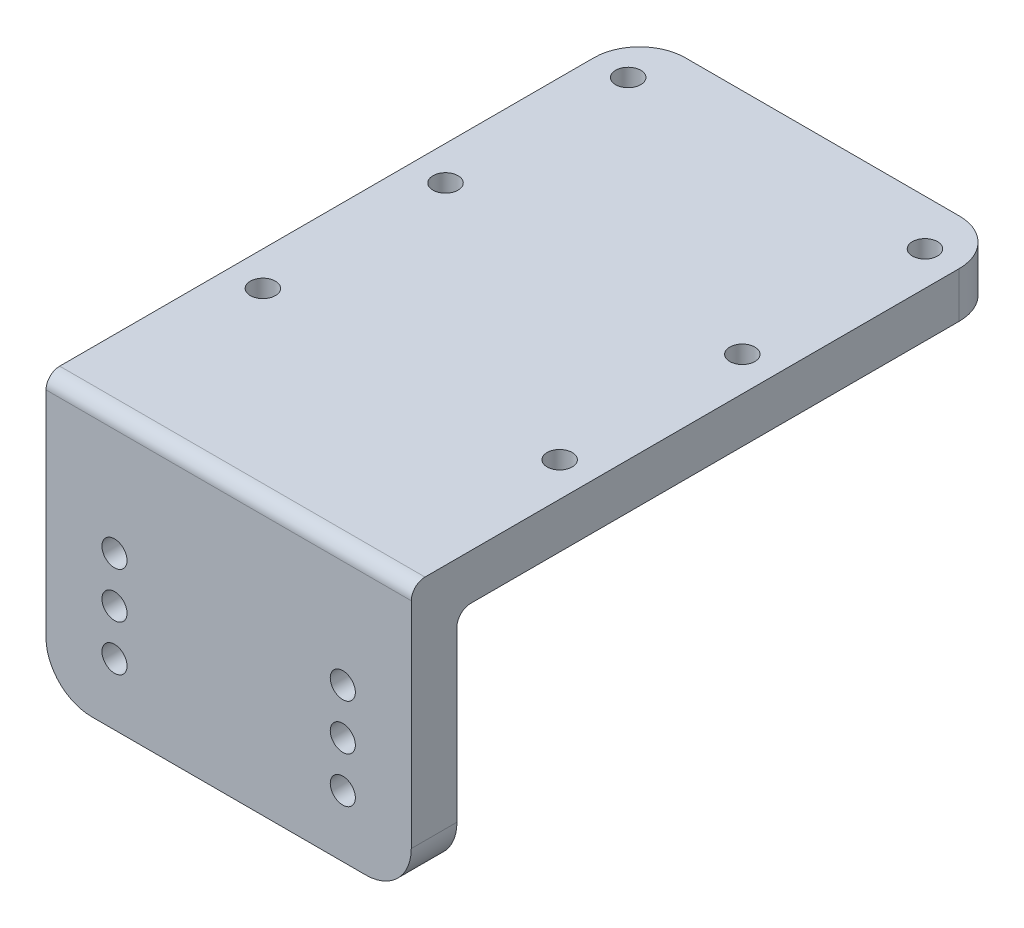
from build123d import *

# Parameters (mm, degrees)
SKETCH1_W           = 80
SKETCH1_H           = 60
BOSS_EXTRUDE1_DEPTH = 10
SKETCH2_W           = 80
SKETCH2_H           = 130
BOSS_EXTRUDE2_DEPTH = 10
CUT_EXTRUDE1_REACH  = 132
SKETCH3_R           = 2.75
CUT_EXTRUDE2_REACH  = 138.015
SKETCH4_R           = 2.75
SKETCH5_W           = 10
SKETCH5_H           = 50
BOSS_EXTRUDE3_DEPTH = 120
CUT_EXTRUDE3_REACH  = 133.624
FILLET1_R           = 10
FILLET2_R           = 3
FILLET3_R           = 3


with BuildPart() as part:
    # Sketch1 → Boss-Extrude1 (new body)
    with BuildSketch(Plane.XY):
        Rectangle(SKETCH1_W, SKETCH1_H)
    extrude(amount=BOSS_EXTRUDE1_DEPTH)

    # Sketch2 → Boss-Extrude2 (add)
    with BuildSketch(Plane(origin=(0, 30, 0), x_dir=(1, 0, 0), z_dir=(0, 1, 0))):
        with Locations((0, 55)):
            Rectangle(SKETCH2_W, SKETCH2_H)
    extrude(amount=-BOSS_EXTRUDE2_DEPTH)

    # Sketch3 → Cut-Extrude1 (cut, up to next)
    with BuildSketch(Plane(origin=(0, 0, 0), x_dir=(-1, 0, 0), z_dir=(0, 0, -1)), mode=Mode.PRIVATE) as cut_extrude1_sk1:
        with Locations((-25, -16.5)):
            Circle(SKETCH3_R)
    cut_extrude1_tool1 = extrude(cut_extrude1_sk1.sketch, amount=-CUT_EXTRUDE1_REACH, mode=Mode.PRIVATE) & part.part
    # Sketch3 → Cut-Extrude1 (cut, up to next)
    with BuildSketch(Plane(origin=(0, 0, 0), x_dir=(-1, 0, 0), z_dir=(0, 0, -1)), mode=Mode.PRIVATE) as cut_extrude1_sk2:
        with Locations((25, -16.5)):
            Circle(SKETCH3_R)
    cut_extrude1_tool2 = extrude(cut_extrude1_sk2.sketch, amount=-CUT_EXTRUDE1_REACH, mode=Mode.PRIVATE) & part.part
    # Sketch3 → Cut-Extrude1 (cut, up to next)
    with BuildSketch(Plane(origin=(0, 0, 0), x_dir=(-1, 0, 0), z_dir=(0, 0, -1)), mode=Mode.PRIVATE) as cut_extrude1_sk3:
        with Locations((-25, -6.5)):
            Circle(SKETCH3_R)
    cut_extrude1_tool3 = extrude(cut_extrude1_sk3.sketch, amount=-CUT_EXTRUDE1_REACH, mode=Mode.PRIVATE) & part.part
    # Sketch3 → Cut-Extrude1 (cut, up to next)
    with BuildSketch(Plane(origin=(0, 0, 0), x_dir=(-1, 0, 0), z_dir=(0, 0, -1)), mode=Mode.PRIVATE) as cut_extrude1_sk4:
        with Locations((25, -6.5)):
            Circle(SKETCH3_R)
    cut_extrude1_tool4 = extrude(cut_extrude1_sk4.sketch, amount=-CUT_EXTRUDE1_REACH, mode=Mode.PRIVATE) & part.part
    # Sketch3 → Cut-Extrude1 (cut, up to next)
    with BuildSketch(Plane(origin=(0, 0, 0), x_dir=(-1, 0, 0), z_dir=(0, 0, -1)), mode=Mode.PRIVATE) as cut_extrude1_sk5:
        with Locations((-25, 3.5)):
            Circle(SKETCH3_R)
    cut_extrude1_tool5 = extrude(cut_extrude1_sk5.sketch, amount=-CUT_EXTRUDE1_REACH, mode=Mode.PRIVATE) & part.part
    # Sketch3 → Cut-Extrude1 (cut, up to next)
    with BuildSketch(Plane(origin=(0, 0, 0), x_dir=(-1, 0, 0), z_dir=(0, 0, -1)), mode=Mode.PRIVATE) as cut_extrude1_sk6:
        with Locations((25, 3.5)):
            Circle(SKETCH3_R)
    cut_extrude1_tool6 = extrude(cut_extrude1_sk6.sketch, amount=-CUT_EXTRUDE1_REACH, mode=Mode.PRIVATE) & part.part
    add(cut_extrude1_tool1.solids().sort_by_distance((25, -16.5, 0))[0], mode=Mode.SUBTRACT)
    add(cut_extrude1_tool2.solids().sort_by_distance((-25, -16.5, 0))[0], mode=Mode.SUBTRACT)
    add(cut_extrude1_tool3.solids().sort_by_distance((25, -6.5, 0))[0], mode=Mode.SUBTRACT)
    add(cut_extrude1_tool4.solids().sort_by_distance((-25, -6.5, 0))[0], mode=Mode.SUBTRACT)
    add(cut_extrude1_tool5.solids().sort_by_distance((25, 3.5, 0))[0], mode=Mode.SUBTRACT)
    add(cut_extrude1_tool6.solids().sort_by_distance((-25, 3.5, 0))[0], mode=Mode.SUBTRACT)

    # Sketch4 → Cut-Extrude2 (cut, up to next)
    with BuildSketch(Plane.XZ.offset(-20), mode=Mode.PRIVATE) as cut_extrude2_sk1:
        with Locations(Location((-32.5, -110, 0), (0, 0, 270))):
            Circle(SKETCH4_R)
    cut_extrude2_tool1 = extrude(cut_extrude2_sk1.sketch, amount=-CUT_EXTRUDE2_REACH, mode=Mode.PRIVATE) & part.part
    # Sketch4 → Cut-Extrude2 (cut, up to next)
    with BuildSketch(Plane.XZ.offset(-20), mode=Mode.PRIVATE) as cut_extrude2_sk2:
        with Locations(Location((32.5, -110, 0), (0, 0, 270))):
            Circle(SKETCH4_R)
    cut_extrude2_tool2 = extrude(cut_extrude2_sk2.sketch, amount=-CUT_EXTRUDE2_REACH, mode=Mode.PRIVATE) & part.part
    # Sketch4 → Cut-Extrude2 (cut, up to next)
    with BuildSketch(Plane.XZ.offset(-20), mode=Mode.PRIVATE) as cut_extrude2_sk3:
        with Locations(Location((-32.5, -70, 0), (0, 0, 270))):
            Circle(SKETCH4_R)
    cut_extrude2_tool3 = extrude(cut_extrude2_sk3.sketch, amount=-CUT_EXTRUDE2_REACH, mode=Mode.PRIVATE) & part.part
    # Sketch4 → Cut-Extrude2 (cut, up to next)
    with BuildSketch(Plane.XZ.offset(-20), mode=Mode.PRIVATE) as cut_extrude2_sk4:
        with Locations(Location((32.5, -70, 0), (0, 0, 270))):
            Circle(SKETCH4_R)
    cut_extrude2_tool4 = extrude(cut_extrude2_sk4.sketch, amount=-CUT_EXTRUDE2_REACH, mode=Mode.PRIVATE) & part.part
    # Sketch4 → Cut-Extrude2 (cut, up to next)
    with BuildSketch(Plane.XZ.offset(-20), mode=Mode.PRIVATE) as cut_extrude2_sk5:
        with Locations(Location((-32.5, -30, 0), (0, 0, 270))):
            Circle(SKETCH4_R)
    cut_extrude2_tool5 = extrude(cut_extrude2_sk5.sketch, amount=-CUT_EXTRUDE2_REACH, mode=Mode.PRIVATE) & part.part
    # Sketch4 → Cut-Extrude2 (cut, up to next)
    with BuildSketch(Plane.XZ.offset(-20), mode=Mode.PRIVATE) as cut_extrude2_sk6:
        with Locations(Location((32.5, -30, 0), (0, 0, 270))):
            Circle(SKETCH4_R)
    cut_extrude2_tool6 = extrude(cut_extrude2_sk6.sketch, amount=-CUT_EXTRUDE2_REACH, mode=Mode.PRIVATE) & part.part
    add(cut_extrude2_tool1.solids().sort_by_distance((-32.5, 20, -110))[0], mode=Mode.SUBTRACT)
    add(cut_extrude2_tool2.solids().sort_by_distance((32.5, 20, -110))[0], mode=Mode.SUBTRACT)
    add(cut_extrude2_tool3.solids().sort_by_distance((-32.5, 20, -70))[0], mode=Mode.SUBTRACT)
    add(cut_extrude2_tool4.solids().sort_by_distance((32.5, 20, -70))[0], mode=Mode.SUBTRACT)
    add(cut_extrude2_tool5.solids().sort_by_distance((-32.5, 20, -30))[0], mode=Mode.SUBTRACT)
    add(cut_extrude2_tool6.solids().sort_by_distance((32.5, 20, -30))[0], mode=Mode.SUBTRACT)

    # Sketch5 → Boss-Extrude3 (add)
    with BuildSketch(Plane(origin=(0, 0, 0), x_dir=(-1, 0, 0), z_dir=(0, 0, -1))):
        with Locations((0, -5)):
            Rectangle(SKETCH5_W, SKETCH5_H)
    extrude(amount=BOSS_EXTRUDE3_DEPTH)

    # Sketch6 → Cut-Extrude3 (cut, up to next)
    with BuildSketch(Plane.ZY.offset(5), mode=Mode.PRIVATE) as cut_extrude3_sk1:
        Polygon((-120, 20), (-120, -30), (0, -30), align=None)
    cut_extrude3_tool1 = extrude(cut_extrude3_sk1.sketch, amount=-CUT_EXTRUDE3_REACH, mode=Mode.PRIVATE) & part.part
    add(cut_extrude3_tool1.solids().sort_by_distance((-5, -13.333333, -80))[0], mode=Mode.SUBTRACT)

    # Fillet1
    fillet1_edges = [part.edges().sort_by_distance(p)[0] for p in [
        (40, 25, -120),
        (-40, 25, -120),
        (40, -30, 5),
        (-40, -30, 5),
    ]]
    fillet(fillet1_edges, radius=FILLET1_R)

    # Fillet2
    fillet2_edges = [part.edges().sort_by_distance(p)[0] for p in [
        (0, 30, 10),
    ]]
    fillet(fillet2_edges, radius=FILLET2_R)

    # Fillet3
    fillet3_edges = [part.edges().sort_by_distance(p)[0] for p in [
        (22.5, 20, 0),
        (-22.5, 20, 0),
        (-5, -5, 0),
        (-5, 20, -60),
        (5, 20, -60),
        (5, -5, 0),
    ]]
    fillet(fillet3_edges, radius=FILLET3_R)


solid = part.part
